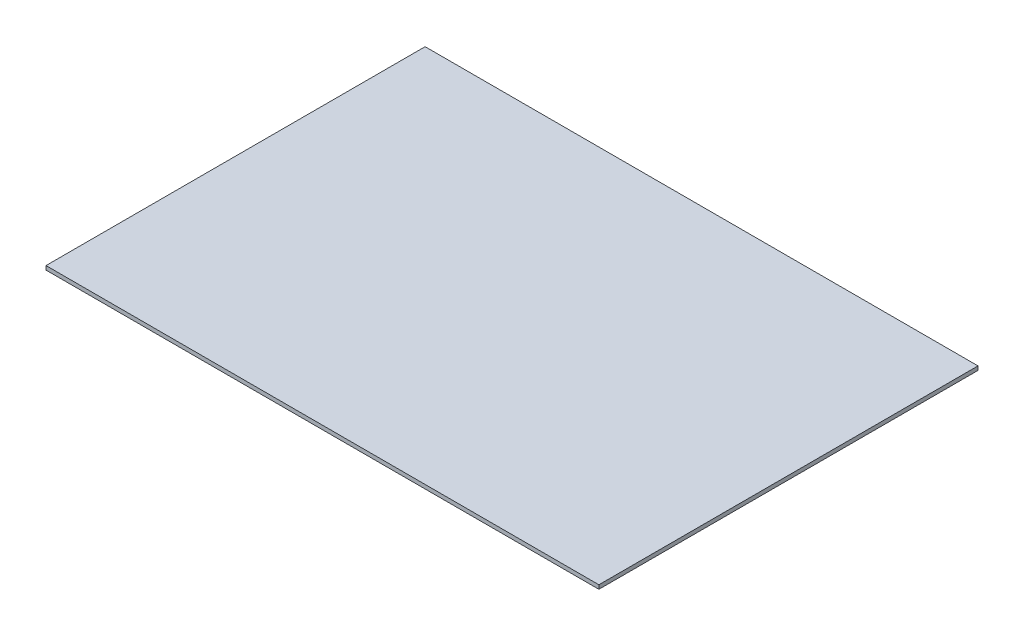
from build123d import *

# Parameters (mm, degrees)
SKETCH1_W           = 889
SKETCH1_H           = 609.6
BOSS_EXTRUDE1_DEPTH = 6.35


with BuildPart() as part:
    # Sketch1 → Boss-Extrude1 (new body)
    with BuildSketch(Plane(origin=(0, 0, 0), x_dir=(1, 0, 0), z_dir=(0, 1, 0))):
        Rectangle(SKETCH1_W, SKETCH1_H)
    extrude(amount=BOSS_EXTRUDE1_DEPTH)


solid = part.part
